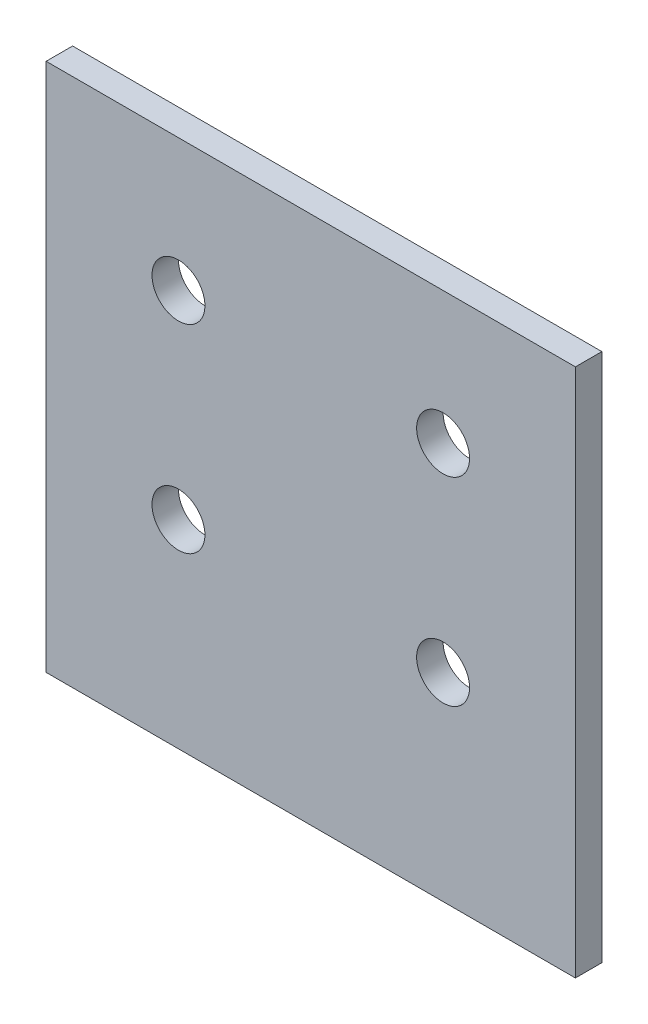
from build123d import *

# Parameters (mm, degrees)
SKETCH1_W           = 40
SKETCH1_H           = 40
SKETCH1_R           = 2
BOSS_EXTRUDE1_DEPTH = 2


with BuildPart() as part:
    # Sketch1 → Boss-Extrude1 (new body)
    with BuildSketch(Plane.XY):
        with Locations((20, 20)):
            Rectangle(SKETCH1_W, SKETCH1_H)
        with Locations((10, 30)):
            Circle(SKETCH1_R, mode=Mode.SUBTRACT)
        with Locations((10, 15)):
            Circle(SKETCH1_R, mode=Mode.SUBTRACT)
        with Locations((30, 30)):
            Circle(SKETCH1_R, mode=Mode.SUBTRACT)
        with Locations((30, 15)):
            Circle(SKETCH1_R, mode=Mode.SUBTRACT)
    extrude(amount=BOSS_EXTRUDE1_DEPTH)


solid = part.part
